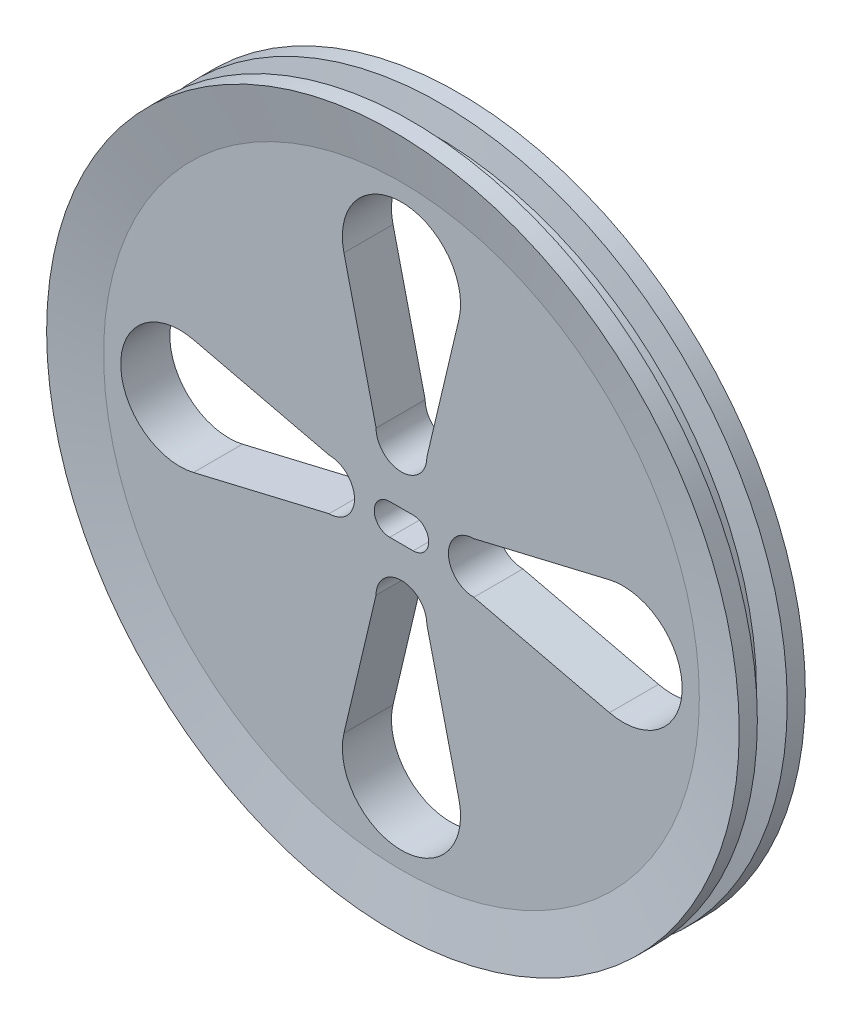
from build123d import *

# Parameters (mm, degrees)
CUT_EXTRUDE3_DEPTH = 59.683963981
CUT_EXTRUDE4_DEPTH = 59.683963981
CIRPATTERN1_COUNT  = 4


with BuildPart() as part:
    # Sketch1 → Revolve1 (revolve)
    with BuildSketch(Plane(origin=(0, 0, 0), x_dir=(0, 0, -1), z_dir=(1, 0, 0)), mode=Mode.PRIVATE) as revolve1_sk:
        Polygon((-2.921, 35.449477671), (-3.937, 41.2115), (-1.778, 41.2115), (-1.2293586, 38.1), (1.2293586, 38.1), (1.778, 41.2115), (3.937, 41.2115), (2.921, 35.449477671), (2.921, 0), (-2.921, 0), align=None)
    revolve(revolve1_sk.sketch.rotate(Axis((0, 0, 2.921), (0, 0, -1)), 90), axis=Axis((0, 0, 2.921), (0, 0, -1)))

    # Sketch4 → Cut-Extrude3 (cut, through all)
    with BuildSketch(Plane(origin=(0, 0, 2.921), x_dir=(-1, 0, 0), z_dir=(0, 0, -1))):
        with BuildLine():
            Line((-3.020640994, 8.609785057), (-6.844218669, 24.749140517))
            ThreePointArc((-6.844218669, 24.749140517), (0, 33.404273107), (6.844218669, 24.749140517))
            Line((6.844218669, 24.749140517), (3.020640994, 8.609785057))
            ThreePointArc((3.020640994, 8.609785057), (0, 5.589144063), (-3.020640994, 8.609785057))
        make_face()
    cut_extrude3 = extrude(amount=CUT_EXTRUDE3_DEPTH, mode=Mode.SUBTRACT)

    # Sketch2 → Cut-Extrude4 (cut, through all)
    with BuildSketch(Plane(origin=(0, 0, 2.921), x_dir=(-1, 0, 0), z_dir=(0, 0, -1))):
        with BuildLine():
            Line((-1.397, 1.8415), (1.397, 1.8415))
            ThreePointArc((1.397, 1.8415), (3.2385, 0), (1.397, -1.8415))
            Line((1.397, -1.8415), (-1.397, -1.8415))
            ThreePointArc((-1.397, -1.8415), (-3.2385, 0), (-1.397, 1.8415))
        make_face()
    extrude(amount=CUT_EXTRUDE4_DEPTH, mode=Mode.SUBTRACT)

    # CirPattern1: Cut-Extrude3 ×4 about axis
    cirpattern1_axis = Axis((0, 0, 0), (0, 0, 1))
    for i in range(1, CIRPATTERN1_COUNT):
        add(cut_extrude3.rotate(cirpattern1_axis, i * 360 / CIRPATTERN1_COUNT), mode=Mode.SUBTRACT)


solid = part.part
